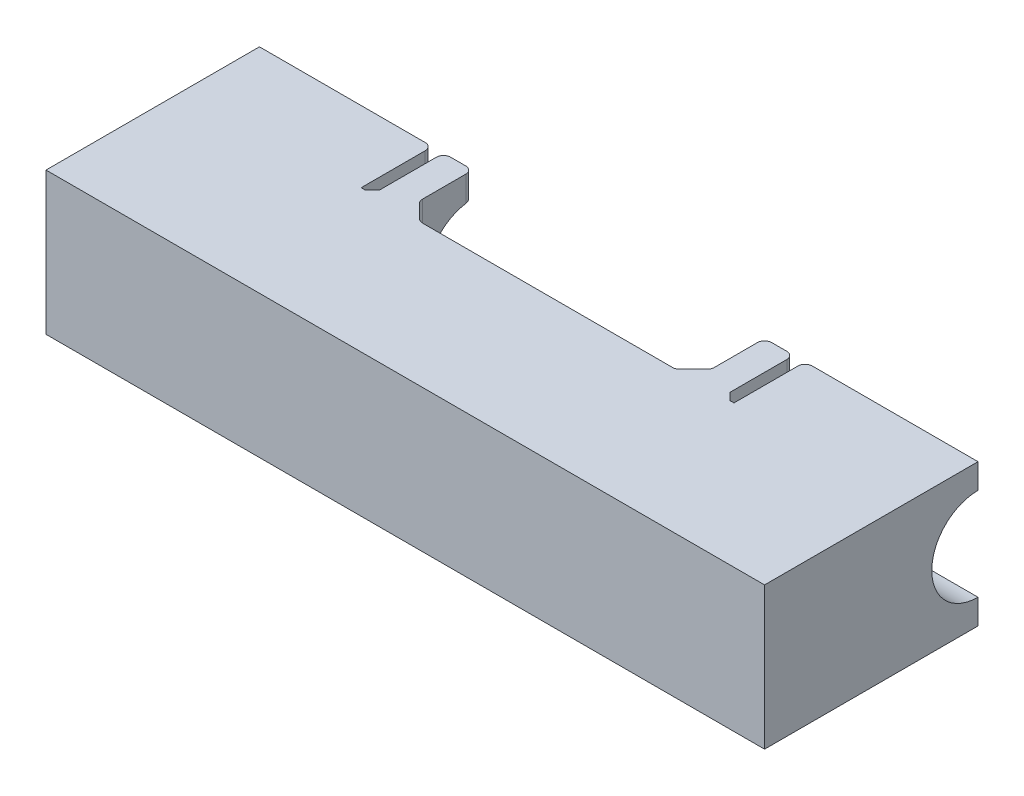
from build123d import *

# Parameters (mm, degrees)
BOSS_EXTRUDE1_DEPTH = 40
SKETCH2_R           = 13
CUT_EXTRUDE1_DEPTH  = 210.771304043
CHAMFER1_SIZE       = 5
FILLET3_R           = 2
CHAMFER2_SIZE       = 2


with BuildPart() as part:
    # Sketch1 → Boss-Extrude1 (new body)
    with BuildSketch(Plane(origin=(0, 0, 0), x_dir=(1, 0, 0), z_dir=(0, 1, 0))):
        Polygon((41, 0), (-41, 0), (-41, 20), (-49.25, 20), (-49.25, 0), (-52.4, 0), (-52.4, 20), (-101, 20), (-101, -40), (101, -40), (101, 20), (52.4, 20), (52.4, 0), (49.25, 0), (49.25, 20), (41, 20), align=None)
    extrude(amount=BOSS_EXTRUDE1_DEPTH)

    # Sketch2 → Cut-Extrude1 (cut, through all)
    with BuildSketch(Plane.ZY.offset(101)):
        with Locations((-20, 20)):
            Circle(SKETCH2_R)
    extrude(amount=-CUT_EXTRUDE1_DEPTH, mode=Mode.SUBTRACT)

    # Chamfer1
    chamfer1_edges = [part.edges().sort_by_distance(p)[0] for p in [
        (-41, 20, 0),
        (41, 20, 0),
    ]]
    chamfer(chamfer1_edges, length=CHAMFER1_SIZE)

    # Fillet3
    fillet3_edges = [part.edges().sort_by_distance(p)[0] for p in [
        (41, 36.5, -20),
        (49.25, 36.5, -20),
        (52.4, 36.5, -20),
        (-52.4, 36.5, -20),
        (-49.25, 36.5, -20),
        (-41, 36.5, -20),
        (41, 3.5, -20),
        (49.25, 3.5, -20),
        (52.4, 3.5, -20),
        (-52.4, 3.5, -20),
        (-49.25, 3.5, -20),
        (-41, 3.5, -20),
        (-36, 20, 0),
        (36, 20, 0),
        (41, 20, -5),
        (-41, 20, -5),
    ]]
    fillet(fillet3_edges, radius=FILLET3_R)

    # Chamfer2
    chamfer2_edges = [part.edges().sort_by_distance(p)[0] for p in [
        (49.25, 20, 0),
        (-49.25, 20, 0),
    ]]
    chamfer(chamfer2_edges, length=CHAMFER2_SIZE)


solid = part.part
